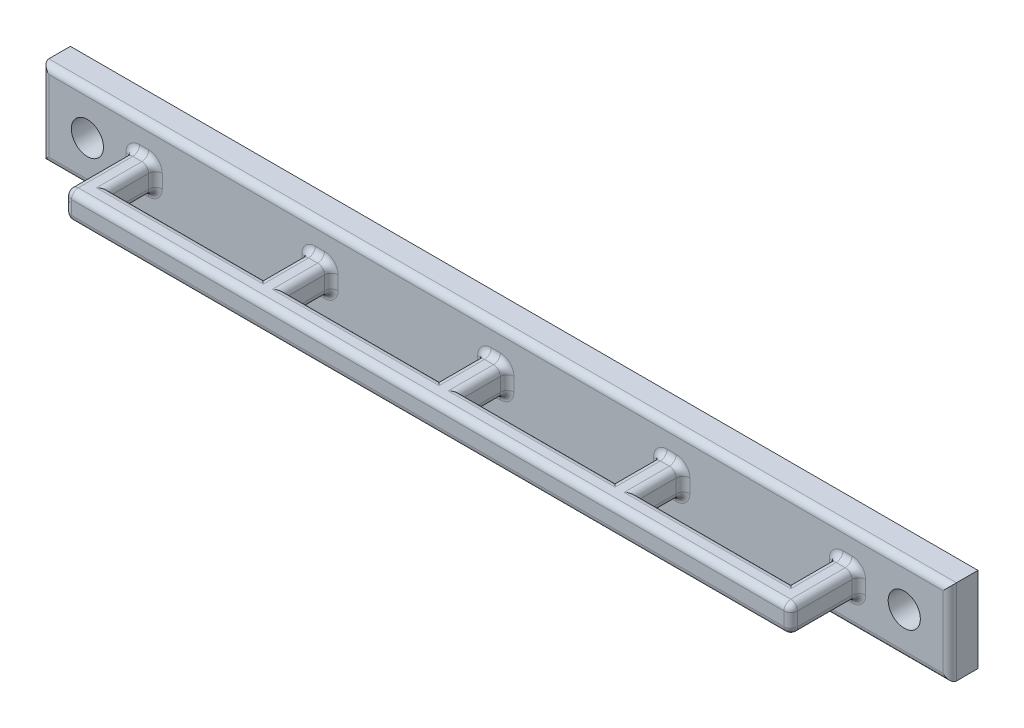
from build123d import *

# Parameters (mm, degrees)
SKETCH2_W                = 101.6
SKETCH2_H                = 9.525
BOSS_EXTRUDE1_DEPTH      = 3.175
M3_CLEARANCE_HOLE1_D     = 3.6
BOSS_EXTRUDE2_DEPTH      = 1.524
BOSS_EXTRUDE2_DEPTH_BACK = 1.524
FILLET1_R                = 0.762


with BuildPart() as part:
    # Sketch2 → Boss-Extrude1 (new body)
    with BuildSketch(Plane.XY):
        with Locations((50.8, 4.7625)):
            Rectangle(SKETCH2_W, SKETCH2_H)
    extrude(amount=BOSS_EXTRUDE1_DEPTH)

    # M3 Clearance Hole1 (through all)
    with Locations(Plane.XY.offset(3.175)):
        with Locations((5.08, 4.7625), (96.52, 4.7625)):
            Hole(M3_CLEARANCE_HOLE1_D / 2)

    # Sketch5 → Boss-Extrude2 (add, two sides: drawn at the far end of the back side and taken through both)
    with BuildSketch(Plane(origin=(0, 4.7625, 0), x_dir=(-1, 0, 0), z_dir=(0, -1, 0)).offset(-BOSS_EXTRUDE2_DEPTH_BACK)):
        Polygon((-10.16, -3.175), (-10.16, -10.795), (-91.44, -10.795), (-91.44, -3.175), (-88.9, -3.175), (-88.9, -8.255), (-71.755, -8.255), (-71.755, -3.175), (-69.215, -3.175), (-69.215, -8.255), (-52.07, -8.255), (-52.07, -3.175), (-49.53, -3.175), (-49.53, -8.255), (-32.385, -8.255), (-32.385, -3.175), (-29.845, -3.175), (-29.845, -8.255), (-12.7, -8.255), (-12.7, -3.175), align=None)
    extrude(amount=BOSS_EXTRUDE2_DEPTH + BOSS_EXTRUDE2_DEPTH_BACK)

    # Fillet1
    fillet1_edges = [part.edges().sort_by_distance(p)[0] for p in [
        (101.6, 4.7625, 3.175),
        (50.8, 9.525, 3.175),
        (12.7, 4.7625, 3.175),
        (11.43, 6.2865, 3.175),
        (10.16, 4.7625, 3.175),
        (10.16, 6.2865, 6.985),
        (10.16, 4.7625, 10.795),
        (50.8, 6.2865, 10.795),
        (91.44, 4.7625, 10.795),
        (91.44, 6.2865, 6.985),
        (91.44, 4.7625, 3.175),
        (90.17, 6.2865, 3.175),
        (88.9, 4.7625, 3.175),
        (88.9, 6.2865, 5.715),
        (80.3275, 6.2865, 8.255),
        (71.755, 6.2865, 5.715),
        (71.755, 4.7625, 3.175),
        (70.485, 6.2865, 3.175),
        (69.215, 4.7625, 3.175),
        (69.215, 6.2865, 5.715),
        (60.6425, 6.2865, 8.255),
        (52.07, 6.2865, 5.715),
        (52.07, 4.7625, 3.175),
        (50.8, 6.2865, 3.175),
        (49.53, 4.7625, 3.175),
        (49.53, 6.2865, 5.715),
        (40.9575, 6.2865, 8.255),
        (32.385, 6.2865, 5.715),
        (32.385, 4.7625, 3.175),
        (31.115, 6.2865, 3.175),
        (29.845, 4.7625, 3.175),
        (29.845, 6.2865, 5.715),
        (21.2725, 6.2865, 8.255),
        (12.7, 6.2865, 5.715),
        (11.43, 3.2385, 3.175),
        (12.7, 3.2385, 5.715),
        (21.2725, 3.2385, 8.255),
        (29.845, 3.2385, 5.715),
        (31.115, 3.2385, 3.175),
        (32.385, 3.2385, 5.715),
        (40.9575, 3.2385, 8.255),
        (49.53, 3.2385, 5.715),
        (50.8, 3.2385, 3.175),
        (52.07, 3.2385, 5.715),
        (60.6425, 3.2385, 8.255),
        (0, 4.7625, 3.175),
        (69.215, 3.2385, 5.715),
        (70.485, 3.2385, 3.175),
        (71.755, 3.2385, 5.715),
        (80.3275, 3.2385, 8.255),
        (88.9, 3.2385, 5.715),
        (90.17, 3.2385, 3.175),
        (91.44, 3.2385, 6.985),
        (50.8, 3.2385, 10.795),
        (10.16, 3.2385, 6.985),
        (50.8, 0, 3.175),
    ]]
    fillet(fillet1_edges, radius=FILLET1_R)


solid = part.part
